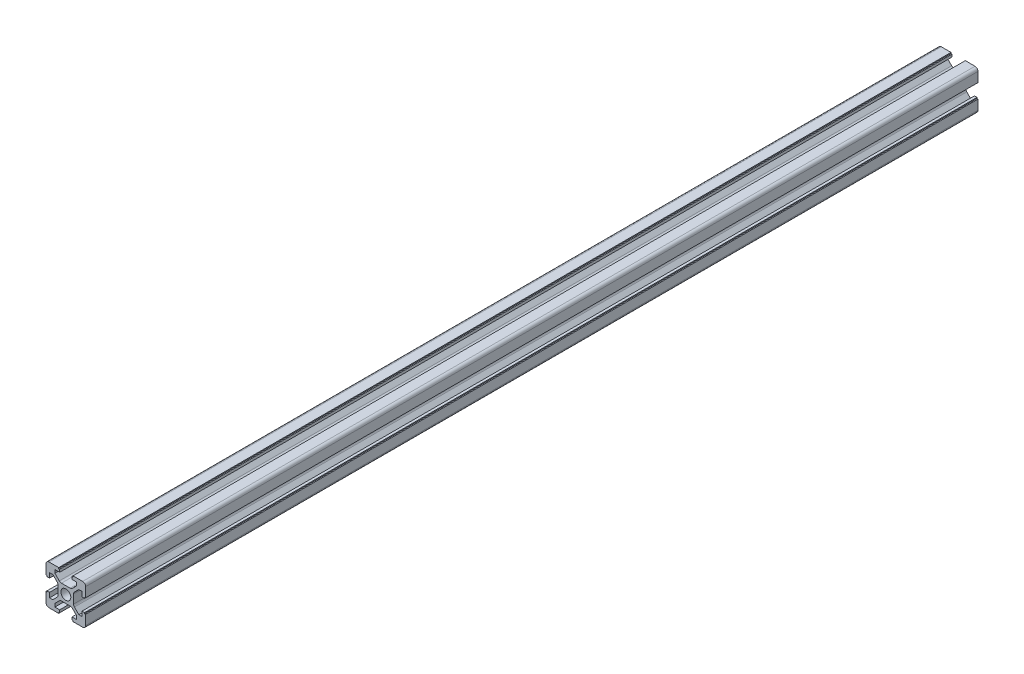
from build123d import *

# Parameters (mm, degrees)
SKETCH_1_R      = 2.5
EXTRUDE_1_DEPTH = 225


with BuildPart() as part:
    # 草图1 → 凸台-拉伸1 (new, symmetric)
    with BuildSketch(Plane.XY):
        with BuildLine():
            Line((-6.560660172, 5.5), (-4.339339828, 3.278679656))
            ThreePointArc((-4.339339828, 3.278679656), (-4.014180701, 2.792044633), (-3.9, 2.218019485))
            Line((-3.9, 2.218019485), (-3.9, -2.218019485))
            ThreePointArc((-3.9, -2.218019485), (-4.014180701, -2.792044633), (-4.339339828, -3.278679656))
            Line((-4.339339828, -3.278679656), (-6.560660172, -5.5))
            Line((-6.560660172, -5.5), (-8.2, -5.5))
            Line((-8.2, -5.5), (-8.2, -3.1))
            Line((-8.2, -3.1), (-9.5, -3.1))
            Line((-9.5, -3.1), (-9.5, -3.6))
            Line((-9.5, -3.6), (-10, -3.6))
            Line((-10, -3.6), (-10, -8.5))
            ThreePointArc((-10, -8.5), (-9.560660172, -9.560660172), (-8.5, -10))
            Line((-8.5, -10), (-3.6, -10))
            Line((-3.6, -10), (-3.6, -9.5))
            Line((-3.6, -9.5), (-3.1, -9.5))
            Line((-3.1, -9.5), (-3.1, -8.2))
            Line((-3.1, -8.2), (-5.5, -8.2))
            Line((-5.5, -8.2), (-5.5, -6.560660172))
            Line((-5.5, -6.560660172), (-3.278679656, -4.339339828))
            ThreePointArc((-3.278679656, -4.339339828), (-2.792044633, -4.014180701), (-2.218019485, -3.9))
            Line((-2.218019485, -3.9), (2.218019485, -3.9))
            ThreePointArc((2.218019485, -3.9), (2.792044633, -4.014180701), (3.278679656, -4.339339828))
            Line((3.278679656, -4.339339828), (5.5, -6.560660172))
            Line((5.5, -6.560660172), (5.5, -8.2))
            Line((5.5, -8.2), (3.1, -8.2))
            Line((3.1, -8.2), (3.1, -9.5))
            Line((3.1, -9.5), (3.6, -9.5))
            Line((3.6, -9.5), (3.6, -10))
            Line((3.6, -10), (8.5, -10))
            ThreePointArc((8.5, -10), (9.560660172, -9.560660172), (10, -8.5))
            Line((10, -8.5), (10, -3.6))
            Line((10, -3.6), (9.5, -3.6))
            Line((9.5, -3.6), (9.5, -3.1))
            Line((9.5, -3.1), (8.2, -3.1))
            Line((8.2, -3.1), (8.2, -5.5))
            Line((8.2, -5.5), (6.560660172, -5.5))
            Line((6.560660172, -5.5), (4.339339828, -3.278679656))
            ThreePointArc((4.339339828, -3.278679656), (4.014180701, -2.792044633), (3.9, -2.218019485))
            Line((3.9, -2.218019485), (3.9, 2.218019485))
            ThreePointArc((3.9, 2.218019485), (4.014180701, 2.792044633), (4.339339828, 3.278679656))
            Line((4.339339828, 3.278679656), (6.560660172, 5.5))
            Line((6.560660172, 5.5), (8.2, 5.5))
            Line((8.2, 5.5), (8.2, 3.1))
            Line((8.2, 3.1), (9.5, 3.1))
            Line((9.5, 3.1), (9.5, 3.6))
            Line((9.5, 3.6), (10, 3.6))
            Line((10, 3.6), (10, 8.5))
            ThreePointArc((10, 8.5), (9.560660172, 9.560660172), (8.5, 10))
            Line((8.5, 10), (3.6, 10))
            Line((3.6, 10), (3.6, 9.5))
            Line((3.6, 9.5), (3.1, 9.5))
            Line((3.1, 9.5), (3.1, 8.2))
            Line((3.1, 8.2), (5.5, 8.2))
            Line((5.5, 8.2), (5.5, 6.560660172))
            Line((5.5, 6.560660172), (3.278679656, 4.339339828))
            ThreePointArc((3.278679656, 4.339339828), (2.792044633, 4.014180701), (2.218019485, 3.9))
            Line((2.218019485, 3.9), (-2.218019485, 3.9))
            ThreePointArc((-2.218019485, 3.9), (-2.792044633, 4.014180701), (-3.278679656, 4.339339828))
            Line((-3.278679656, 4.339339828), (-5.5, 6.560660172))
            Line((-5.5, 6.560660172), (-5.5, 8.2))
            Line((-5.5, 8.2), (-3.1, 8.2))
            Line((-3.1, 8.2), (-3.1, 9.5))
            Line((-3.1, 9.5), (-3.6, 9.5))
            Line((-3.6, 9.5), (-3.6, 10))
            Line((-3.6, 10), (-8.5, 10))
            ThreePointArc((-8.5, 10), (-9.560660172, 9.560660172), (-10, 8.5))
            Line((-10, 8.5), (-10, 3.6))
            Line((-10, 3.6), (-9.5, 3.6))
            Line((-9.5, 3.6), (-9.5, 3.1))
            Line((-9.5, 3.1), (-8.2, 3.1))
            Line((-8.2, 3.1), (-8.2, 5.5))
            Line((-8.2, 5.5), (-6.560660172, 5.5))
        make_face()
        Circle(SKETCH_1_R, mode=Mode.SUBTRACT)
    extrude(amount=EXTRUDE_1_DEPTH, both=True)


solid = part.part
